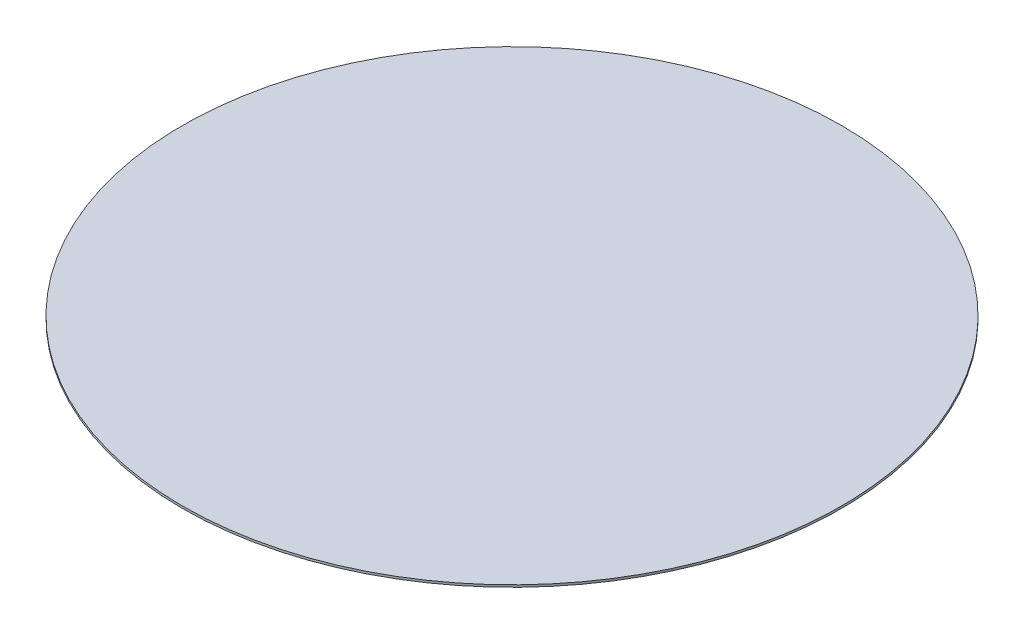
from build123d import *

# Parameters (mm, degrees)
SKETCH1_R           = 38.1
BOSS_EXTRUDE1_DEPTH = 0.254


with BuildPart() as part:
    # Sketch1 → Boss-Extrude1 (new body)
    with BuildSketch(Plane(origin=(0, 0, 0), x_dir=(1, 0, 0), z_dir=(0, 1, 0))):
        Circle(SKETCH1_R)
    extrude(amount=BOSS_EXTRUDE1_DEPTH)


solid = part.part
